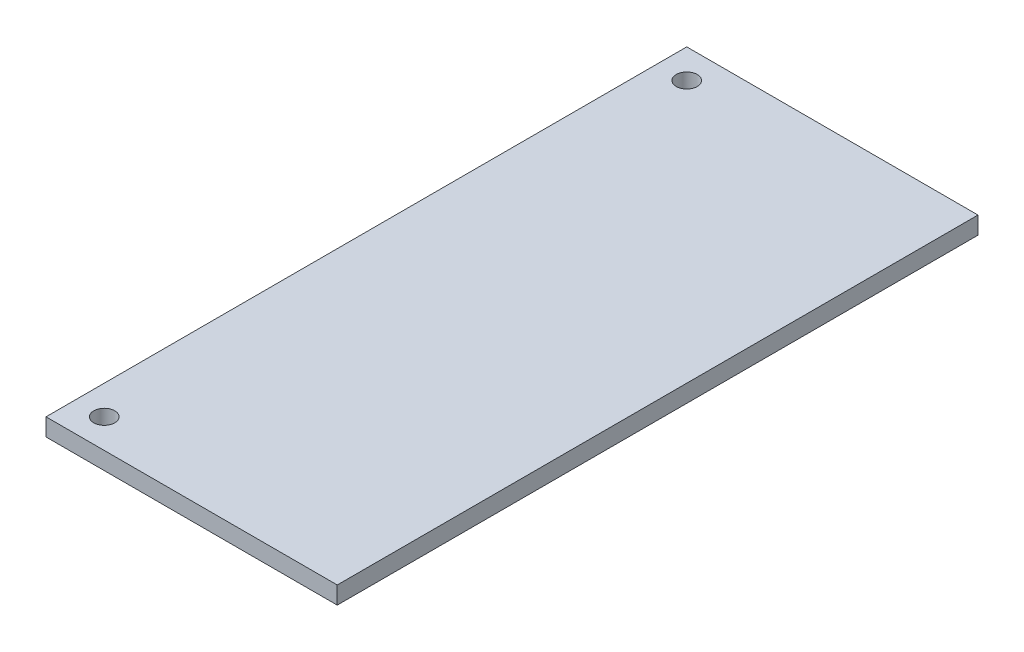
from build123d import *

# Parameters (mm, degrees)
SKETCH1_W                = 50
SKETCH1_H                = 110
BOSS_EXTRUDE1_DEPTH      = 3
M3_CLEARANCE_HOLE1_D     = 3.6
M3_CLEARANCE_HOLE1_DEPTH = 6
M3_CLEARANCE_HOLE1_TIP   = 1.081549114


with BuildPart() as part:
    # Sketch1 → Boss-Extrude1 (new body)
    with BuildSketch(Plane(origin=(0, 0, 0), x_dir=(1, 0, 0), z_dir=(0, 1, 0))):
        Rectangle(SKETCH1_W, SKETCH1_H)
    extrude(amount=BOSS_EXTRUDE1_DEPTH)

    # M3 Clearance Hole1
    with Locations(Plane(origin=(0, 3, 0), x_dir=(1, 0, 0), z_dir=(0, 1, 0))):
        with Locations((-20, 50), (-20, -50)):
            Hole(M3_CLEARANCE_HOLE1_D / 2, depth=M3_CLEARANCE_HOLE1_DEPTH)
            with Locations((0, 0, -(M3_CLEARANCE_HOLE1_DEPTH + M3_CLEARANCE_HOLE1_TIP / 2))):  # 118° drill point
                Cone(0, M3_CLEARANCE_HOLE1_D / 2, M3_CLEARANCE_HOLE1_TIP, mode=Mode.SUBTRACT)


solid = part.part
